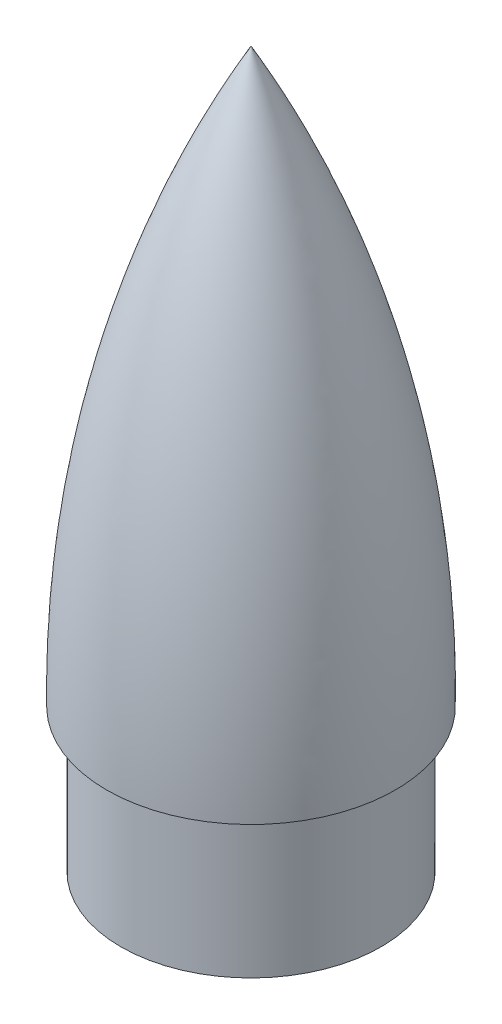
from build123d import *


with BuildPart() as part:
    # Эскиз1 → Повернуть1 (revolve)
    with BuildSketch(Plane.XY, mode=Mode.PRIVATE) as revolve_1_sk:
        with BuildLine():
            Line((0, 100), (0, 0))
            Line((0, 0), (-18.2, 0))
            Line((-18.2, 0), (-18.2, 20))
            Line((-18.2, 20), (-20.2, 20))
            ThreePointArc((-20.2, 20), (-15.345615819, 61.324517994), (0, 100))
        make_face()
    revolve(revolve_1_sk.sketch.rotate(Axis((0, 40.264519068, 0), (0, -1, 0)), 270), axis=Axis((0, 40.264519068, 0), (0, -1, 0)))


solid = part.part
